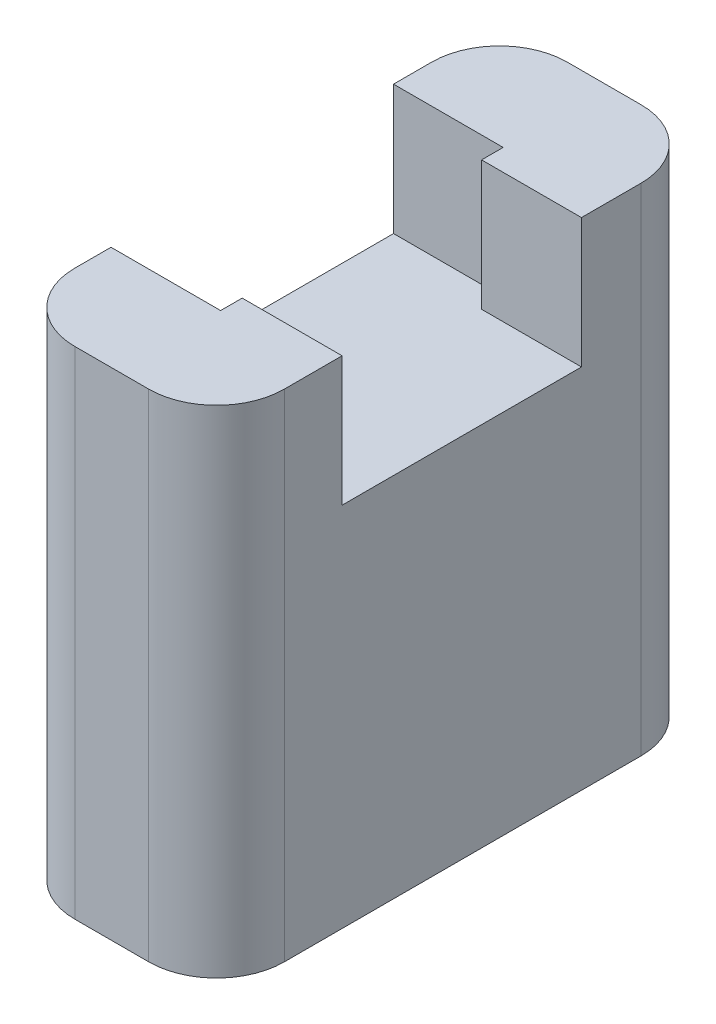
from build123d import *

# Parameters (mm, degrees)
CROQUIS1_R                 = 2.4
SALIENTE_EXTRUIR1_DEPTH    = 3
SALIENTE_EXTRUIR2_DEPTH    = 6
CORTAR_EXTRUIR4_DEPTH      = 48.064644057
CORTAR_EXTRUIR4_DEPTH_BACK = 3
SALIENTE_EXTRUIR3_START    = 14
SALIENTE_EXTRUIR3_DEPTH    = 14


with BuildPart() as part:
    # Croquis1 → Saliente-Extruir1 (new body)
    with BuildSketch(Plane(origin=(0, 0, 0), x_dir=(1, 0, 0), z_dir=(0, 1, 0))):
        with BuildLine():
            Line((35.117506554, -10.768616799), (17.851894103, -10.768616799))
            Line((17.851894103, -10.768616799), (17.851894103, -15.511473942))
            ThreePointArc((17.851894103, -15.511473942), (16.931372558, -17.73380954), (14.70903696, -18.654331085))
            Line((14.70903696, -18.654331085), (11.280465531, -18.654331085))
            ThreePointArc((11.280465531, -18.654331085), (9.058129933, -17.73380954), (8.137608389, -15.511473942))
            Line((8.137608389, -15.511473942), (8.137608389, 1.036415275))
            ThreePointArc((8.137608389, 1.036415275), (9.058129933, 3.258750873), (11.280465531, 4.179272418))
            Line((11.280465531, 4.179272418), (14.70903696, 4.179272418))
            ThreePointArc((14.70903696, 4.179272418), (16.931372558, 3.258750873), (17.851894103, 1.036415275))
            Line((17.851894103, 1.036415275), (17.851894103, -3.797188228))
            Line((17.851894103, -3.797188228), (35.117506554, -3.797188228))
            ThreePointArc((35.117506554, -3.797188228), (42.791315147, -7.282902513), (35.117506554, -10.768616799))
        make_face()
        with Locations(Location((38.162743718, -7.282902513, 0), (0, 0, 270))):
            Circle(CROQUIS1_R, mode=Mode.SUBTRACT)
    extrude(amount=SALIENTE_EXTRUIR1_DEPTH)

    # Croquis2 → Saliente-Extruir2 (add)
    with BuildSketch(Plane(origin=(0, 3, 0), x_dir=(1, 0, 0), z_dir=(0, 1, 0))):
        with BuildLine():
            Line((13.22040734, -0.732902513), (13.22040734, -1.732902513))
            Line((13.22040734, -1.732902513), (17.851894103, -1.732902513))
            Line((17.851894103, -1.732902513), (17.851894103, 1.036415275))
            ThreePointArc((17.851894103, 1.036415275), (16.931372558, 3.258750873), (14.70903696, 4.179272418))
            Line((14.70903696, 4.179272418), (11.280465531, 4.179272418))
            ThreePointArc((11.280465531, 4.179272418), (9.058129933, 3.258750873), (8.137608389, 1.036415275))
            Line((8.137608389, 1.036415275), (8.137608389, -0.732902513))
            Line((8.137608389, -0.732902513), (13.22040734, -0.732902513))
        make_face()
        with BuildLine():
            Line((17.851894103, -12.832902513), (13.22040734, -12.832902513))
            Line((13.22040734, -12.832902513), (13.22040734, -13.832902513))
            Line((13.22040734, -13.832902513), (8.137608389, -13.832902513))
            Line((8.137608389, -13.832902513), (8.137608389, -15.511473942))
            ThreePointArc((8.137608389, -15.511473942), (9.058129933, -17.73380954), (11.280465531, -18.654331085))
            Line((11.280465531, -18.654331085), (14.70903696, -18.654331085))
            ThreePointArc((14.70903696, -18.654331085), (16.931372558, -17.73380954), (17.851894103, -15.511473942))
            Line((17.851894103, -15.511473942), (17.851894103, -12.832902513))
        make_face()
    extrude(amount=SALIENTE_EXTRUIR2_DEPTH)

    # Croquis3 → Cortar-Extruir4 (cut, two sides: drawn at the far end of the back side and taken through both)
    with BuildSketch(Plane(origin=(0, 3, 0), x_dir=(1, 0, 0), z_dir=(0, 1, 0)).offset(-CORTAR_EXTRUIR4_DEPTH_BACK)):
        Polygon((17.851894103, 64.354823399), (17.851894103, -3.797188228), (17.851894103, -10.768616799), (17.851894103, -78.920628426), (154.155917357, -78.920628426), (154.155917357, 64.354823399), align=None)
    extrude(amount=CORTAR_EXTRUIR4_DEPTH + CORTAR_EXTRUIR4_DEPTH_BACK, mode=Mode.SUBTRACT)

    # Croquis4 → Saliente-Extruir3 (add)
    with BuildSketch(Plane.XZ.offset(SALIENTE_EXTRUIR3_START)):
        with BuildLine():
            Line((17.851894103, 15.511473942), (17.851894103, -1.036415275))
            ThreePointArc((17.851894103, -1.036415275), (16.931372558, -3.258750873), (14.70903696, -4.179272418))
            Line((14.70903696, -4.179272418), (11.280465531, -4.179272418))
            ThreePointArc((11.280465531, -4.179272418), (9.058129933, -3.258750873), (8.137608389, -1.036415275))
            Line((8.137608389, -1.036415275), (8.137608389, 15.511473942))
            ThreePointArc((8.137608389, 15.511473942), (9.058129933, 17.73380954), (11.280465531, 18.654331085))
            Line((11.280465531, 18.654331085), (14.70903696, 18.654331085))
            ThreePointArc((14.70903696, 18.654331085), (16.931372558, 17.73380954), (17.851894103, 15.511473942))
        make_face()
    extrude(amount=-SALIENTE_EXTRUIR3_DEPTH)


solid = part.part
